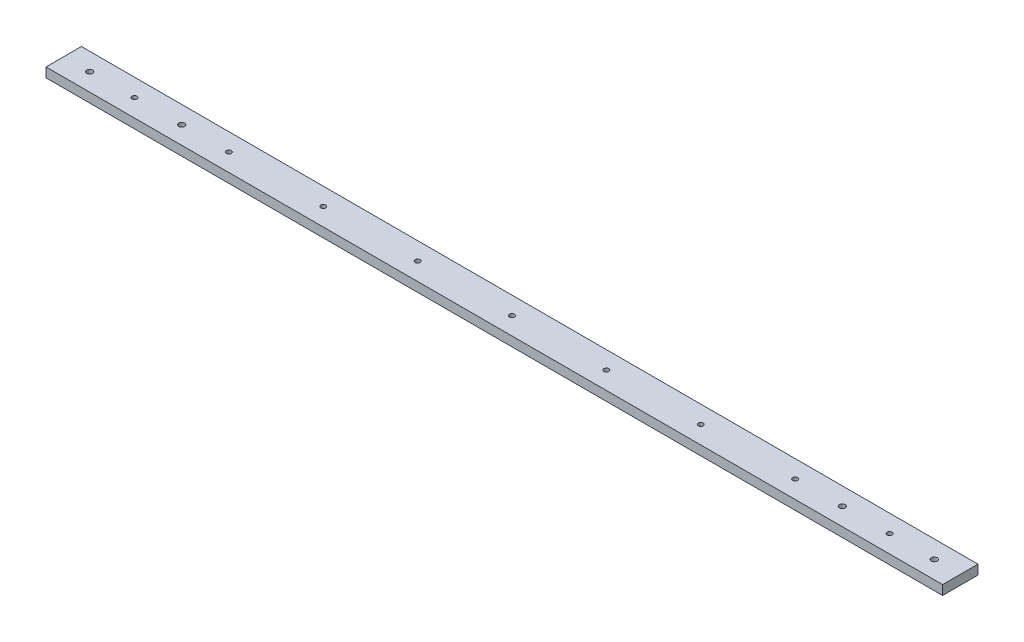
from build123d import *

# Parameters (mm, degrees)
SKETCH1_W           = 760
SKETCH1_H           = 30
BOSS_EXTRUDE1_DEPTH = 8
M6_TAPPED_HOLE1_D   = 5
M5_TAPPED_HOLE1_D   = 4.2


with BuildPart() as part:
    # Sketch1 → Boss-Extrude1 (new body)
    with BuildSketch(Plane(origin=(0, 0, 0), x_dir=(1, 0, 0), z_dir=(0, 1, 0))):
        Rectangle(SKETCH1_W, SKETCH1_H)
    extrude(amount=BOSS_EXTRUDE1_DEPTH)

    # M6 Tapped Hole1 (through all)
    with Locations(Plane(origin=(0, 8, 0), x_dir=(1, 0, 0), z_dir=(0, 1, 0))):
        with Locations((-358, 0), (-280, 0), (280, 0), (358, 0)):
            Hole(M6_TAPPED_HOLE1_D / 2)

    # M5 Tapped Hole1 (through all)
    with Locations(Plane(origin=(0, 8, 0), x_dir=(1, 0, 0), z_dir=(0, 1, 0))):
        with Locations((0, 0), (80, 0), (160, 0), (240, 0), (320, 0), (-80, 0), (-160, 0), (-240, 0), (-320, 0)):
            Hole(M5_TAPPED_HOLE1_D / 2)


solid = part.part
